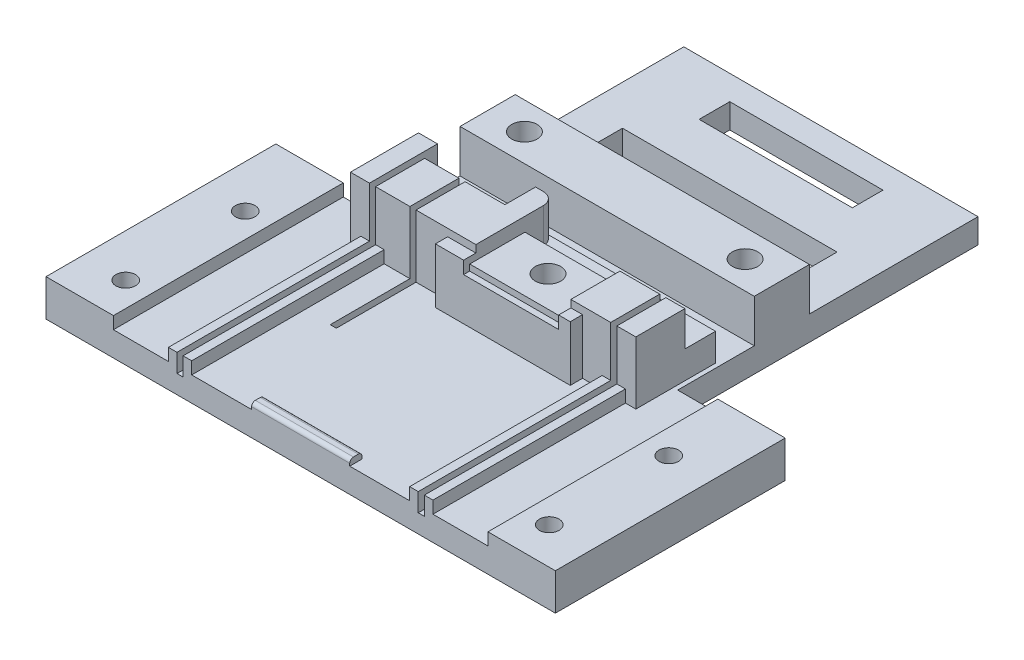
from build123d import *

# Parameters (mm, degrees)
SKETCH1_R           = 1.6
SKETCH1_W           = 25
SKETCH1_H           = 5
SKETCH1_W_2         = 35
SKETCH1_H_2         = 11
BOSS_EXTRUDE1_DEPTH = 4
CHAMFER1_SIZE       = 1.4
SKETCH2_W           = 48
SKETCH2_H           = 9
SKETCH2_R           = 2.075
BOSS_EXTRUDE2_DEPTH = 7
SKETCH3_W           = 11
SKETCH3_H           = 37.5
SKETCH3_R           = 1.6
BOSS_EXTRUDE3_DEPTH = 2
SKETCH4_W           = 5.6
SKETCH4_H           = 8
BOSS_EXTRUDE4_DEPTH = 10.2
SKETCH5_W           = 1.4
SKETCH5_H           = 31.4
BOSS_EXTRUDE5_DEPTH = 2
CUT_EXTRUDE1_DEPTH  = 1
SKETCH8_W           = 26.1
SKETCH8_H           = 5
CUT_EXTRUDE2_DEPTH  = 5.7
SKETCH9_W           = 15.5
SKETCH9_H           = 10
CUT_EXTRUDE3_DEPTH  = 2.25
SKETCH10_W          = 4.6
SKETCH10_H          = 2
SKETCH10_W_2        = 1.9
CUT_EXTRUDE4_DEPTH  = 1.2
SKETCH11_W          = 15.5
SKETCH11_H          = 1
CUT_EXTRUDE5_DEPTH  = 1
SKETCH12_R          = 2.075
CUT_EXTRUDE6_DEPTH  = 7
FILLET1_R           = 2
CUT_EXTRUDE7_REACH  = 97.282
SKETCH14_W          = 16
SKETCH14_H          = 2
BOSS_EXTRUDE6_DEPTH = 1
FILLET2_R           = 0.6


with BuildPart() as part:
    # Sketch1 → Boss-Extrude1 (new body)
    with BuildSketch(Plane(origin=(0, 0, 0), x_dir=(1, 0, 0), z_dir=(0, 1, 0))):
        Polygon((0, 0), (0, 37.5), (17.55, 37.5), (17.55, 86.5), (65.55, 86.5), (65.55, 37.5), (83.1, 37.5), (83.1, 0), align=None)
        with Locations(Location((7, 25.5, 0), (0, 0, 270))):
            Circle(SKETCH1_R, mode=Mode.SUBTRACT)
        with Locations(Location((7, 6, 0), (0, 0, 270))):
            Circle(SKETCH1_R, mode=Mode.SUBTRACT)
        with Locations(Location((76.1, 6, 0), (0, 0, 270))):
            Circle(SKETCH1_R, mode=Mode.SUBTRACT)
        with Locations(Location((76.1, 25.5, 0), (0, 0, 270))):
            Circle(SKETCH1_R, mode=Mode.SUBTRACT)
        with Locations((41.55, 80)):
            Rectangle(SKETCH1_W, SKETCH1_H, mode=Mode.SUBTRACT)
        with Locations((41.55, 64.5)):
            Rectangle(SKETCH1_W_2, SKETCH1_H_2, mode=Mode.SUBTRACT)
    extrude(amount=BOSS_EXTRUDE1_DEPTH)

    # Chamfer1
    chamfer1_edges = [part.edges().sort_by_distance(p)[0] for p in [
        (7, 0, -27.1),
        (7, 0, -7.6),
        (76.1, 0, -7.6),
        (76.1, 0, -27.1),
    ]]
    chamfer(chamfer1_edges, length=CHAMFER1_SIZE)

    # Sketch2 → Boss-Extrude2 (add)
    with BuildSketch(Plane(origin=(0, 4, 0), x_dir=(1, 0, 0), z_dir=(0, 1, 0))):
        with Locations((41.55, 54.5)):
            Rectangle(SKETCH2_W, SKETCH2_H)
        with Locations(Location((23.55, 54.502162277, 0), (0, 0, 270))):
            Circle(SKETCH2_R, mode=Mode.SUBTRACT)
        with Locations(Location((59.55, 54.502162277, 0), (0, 0, 270))):
            Circle(SKETCH2_R, mode=Mode.SUBTRACT)
    extrude(amount=BOSS_EXTRUDE2_DEPTH)

    # Sketch3 → Boss-Extrude3 (add)
    # profile 1 of 2: a face of its own
    with BuildSketch(Plane(origin=(0, 4, 0), x_dir=(1, 0, 0), z_dir=(0, 1, 0))):
        with Locations((5.5, 18.75)):
            Rectangle(SKETCH3_W, SKETCH3_H)
        with Locations(Location((7, 25.5, 0), (0, 0, 90))):
            Circle(SKETCH3_R, mode=Mode.SUBTRACT)
        with Locations(Location((7, 6, 0), (0, 0, 90))):
            Circle(SKETCH3_R, mode=Mode.SUBTRACT)
    # profile 2 of 2: a face of its own
    with BuildSketch(Plane(origin=(0, 4, 0), x_dir=(1, 0, 0), z_dir=(0, 1, 0))):
        with Locations((77.6, 18.75)):
            Rectangle(SKETCH3_W, SKETCH3_H)
        with Locations(Location((76.1, 6, 0), (0, 0, 90))):
            Circle(SKETCH3_R, mode=Mode.SUBTRACT)
        with Locations(Location((76.1, 25.5, 0), (0, 0, 90))):
            Circle(SKETCH3_R, mode=Mode.SUBTRACT)
    extrude(amount=BOSS_EXTRUDE3_DEPTH)

    # Sketch4 → Boss-Extrude4 (add)
    with BuildSketch(Plane(origin=(0, 4, 0), x_dir=(1, 0, 0), z_dir=(0, 1, 0))):
        Polygon((18.27, 42.5), (18.27, 31.4), (21.37, 31.4), (21.37, 40.6), (35.47, 40.6), (35.47, 39.4), (28.97, 39.4), (28.97, 31.4), (34.13, 31.4), (34.13, 29.4), (56.13, 29.4), (56.13, 31.4), (60.73, 31.4), (60.73, 39.4), (54.23, 39.4), (54.23, 40.6), (61.73, 40.6), (61.73, 31.4), (64.83, 31.4), (64.83, 44.4), (25.1, 44.4), (25.1, 42.5), align=None)
        with Locations((25.17, 35.4)):
            Rectangle(SKETCH4_W, SKETCH4_H)
    extrude(amount=BOSS_EXTRUDE4_DEPTH)

    # Sketch5 → Boss-Extrude5 (add)
    with BuildSketch(Plane(origin=(0, 4, 0), x_dir=(1, 0, 0), z_dir=(0, 1, 0))):
        with Locations((20.67, 15.7)):
            Rectangle(SKETCH5_W, SKETCH5_H)
        with Locations((23.07, 15.7)):
            Rectangle(SKETCH5_W, SKETCH5_H)
        with Locations((60.03, 15.7)):
            Rectangle(SKETCH5_W, SKETCH5_H)
        with Locations((62.43, 15.7)):
            Rectangle(SKETCH5_W, SKETCH5_H)
    extrude(amount=BOSS_EXTRUDE5_DEPTH)

    # Sketch7 → Cut-Extrude1 (cut)
    with BuildSketch(Plane(origin=(0, 4, 0), x_dir=(1, 0, 0), z_dir=(0, 1, 0))):
        Polygon((28.97, 31.4), (28.97, 18.4), (27.97, 18.4), (27.97, 31.4), (27.97, 39.4), (22.37, 39.4), (22.37, 0), (21.37, 0), (21.37, 40.6), (35.47, 40.6), (35.47, 39.4), (28.97, 39.4), align=None)
        Polygon((60.73, 0), (61.73, 0), (61.73, 40.6), (54.23, 40.6), (54.23, 39.4), (60.73, 39.4), align=None)
    extrude(amount=-CUT_EXTRUDE1_DEPTH, mode=Mode.SUBTRACT)

    # Sketch8 → Cut-Extrude2 (cut)
    with BuildSketch(Plane(origin=(0, 14.2, 0), x_dir=(1, 0, 0), z_dir=(0, 1, 0))):
        Polygon((35.47, 40.6), (35.47, 44.4), (25.1, 44.4), (25.1, 42.5), (21.37, 42.5), (21.37, 40.6), align=None)
        with Locations((51.78, 41.9)):
            Rectangle(SKETCH8_W, SKETCH8_H)
    extrude(amount=-CUT_EXTRUDE2_DEPTH, mode=Mode.SUBTRACT)

    # Sketch9 → Cut-Extrude3 (cut)
    with BuildSketch(Plane(origin=(0, 14.2, 0), x_dir=(1, 0, 0), z_dir=(0, 1, 0))):
        with Locations((46.48, 34.4)):
            Rectangle(SKETCH9_W, SKETCH9_H)
    extrude(amount=-CUT_EXTRUDE3_DEPTH, mode=Mode.SUBTRACT)

    # Sketch10 → Cut-Extrude4 (cut)
    with BuildSketch(Plane(origin=(0, 14.2, 0), x_dir=(1, 0, 0), z_dir=(0, 1, 0))):
        with Locations((36.43, 30.4)):
            Rectangle(SKETCH10_W, SKETCH10_H)
        with Locations((55.18, 30.4)):
            Rectangle(SKETCH10_W_2, SKETCH10_H)
    extrude(amount=-CUT_EXTRUDE4_DEPTH, mode=Mode.SUBTRACT)

    # Sketch11 → Cut-Extrude5 (cut)
    with BuildSketch(Plane(origin=(0, 11.95, 0), x_dir=(1, 0, 0), z_dir=(0, 1, 0))):
        with Locations((46.48, 29.9)):
            Rectangle(SKETCH11_W, SKETCH11_H)
    extrude(amount=-CUT_EXTRUDE5_DEPTH, mode=Mode.SUBTRACT)

    # Sketch12 → Cut-Extrude6 (cut)
    with BuildSketch(Plane(origin=(0, 11.95, 0), x_dir=(1, 0, 0), z_dir=(0, 1, 0))):
        with Locations(Location((46.5, 35.4, 0), (0, 0, 270))):
            Circle(SKETCH12_R)
    extrude(amount=-CUT_EXTRUDE6_DEPTH, mode=Mode.SUBTRACT)

    # Fillet1
    fillet1_edges = [part.edges().sort_by_distance(p)[0] for p in [
        (38.73, 11.35, -44.4),
    ]]
    fillet(fillet1_edges, radius=FILLET1_R)

    # Sketch13 → Cut-Extrude7 (cut, up to next)
    with BuildSketch(Plane(origin=(0, 0, -44.4), x_dir=(-1, 0, 0), z_dir=(0, 0, -1)), mode=Mode.PRIVATE) as cut_extrude7_sk1:
        with BuildLine():
            Line((-58.73, 8.5), (-58.73, 5.57))
            ThreePointArc((-58.73, 5.57), (-57.38, 4.22), (-56.03, 5.57))
            Line((-56.03, 5.57), (-56.03, 8.5))
            Line((-56.03, 8.5), (-58.73, 8.5))
        make_face()
    cut_extrude7_tool1 = extrude(cut_extrude7_sk1.sketch, amount=-CUT_EXTRUDE7_REACH, mode=Mode.PRIVATE) & part.part
    # Sketch13 → Cut-Extrude7 (cut, up to next)
    with BuildSketch(Plane(origin=(0, 0, -44.4), x_dir=(-1, 0, 0), z_dir=(0, 0, -1)), mode=Mode.PRIVATE) as cut_extrude7_sk2:
        with BuildLine():
            Line((-33.57, 8.5), (-33.57, 6.8))
            ThreePointArc((-33.57, 6.8), (-32.22, 5.45), (-30.87, 6.8))
            Line((-30.87, 6.8), (-30.87, 8.5))
            Line((-30.87, 8.5), (-33.57, 8.5))
        make_face()
    cut_extrude7_tool2 = extrude(cut_extrude7_sk2.sketch, amount=-CUT_EXTRUDE7_REACH, mode=Mode.PRIVATE) & part.part
    # Sketch13 → Cut-Extrude7 (cut, up to next)
    with BuildSketch(Plane(origin=(0, 0, -44.4), x_dir=(-1, 0, 0), z_dir=(0, 0, -1)), mode=Mode.PRIVATE) as cut_extrude7_sk3:
        with BuildLine():
            Line((-26.49, 5.57), (-26.49, 8.5))
            Line((-26.49, 8.5), (-23.79, 8.5))
            Line((-23.79, 8.5), (-23.79, 5.57))
            ThreePointArc((-23.79, 5.57), (-25.14, 4.22), (-26.49, 5.57))
        make_face()
    cut_extrude7_tool3 = extrude(cut_extrude7_sk3.sketch, amount=-CUT_EXTRUDE7_REACH, mode=Mode.PRIVATE) & part.part
    add(cut_extrude7_tool1.solids().sort_by_distance((57.38, 6.49348, -44.4))[0], mode=Mode.SUBTRACT)
    add(cut_extrude7_tool2.solids().sort_by_distance((32.22, 7.10341, -44.4))[0], mode=Mode.SUBTRACT)
    add(cut_extrude7_tool3.solids().sort_by_distance((25.14, 6.49348, -44.4))[0], mode=Mode.SUBTRACT)

    # Sketch14 → Boss-Extrude6 (add)
    with BuildSketch(Plane(origin=(0, 4, 0), x_dir=(1, 0, 0), z_dir=(0, 1, 0))):
        with Locations((41.55, 1)):
            Rectangle(SKETCH14_W, SKETCH14_H)
    extrude(amount=BOSS_EXTRUDE6_DEPTH)

    # Fillet2
    fillet2_edges = [part.edges().sort_by_distance(p)[0] for p in [
        (41.55, 5, 0),
        (41.55, 5, -2),
    ]]
    fillet(fillet2_edges, radius=FILLET2_R)


solid = part.part
